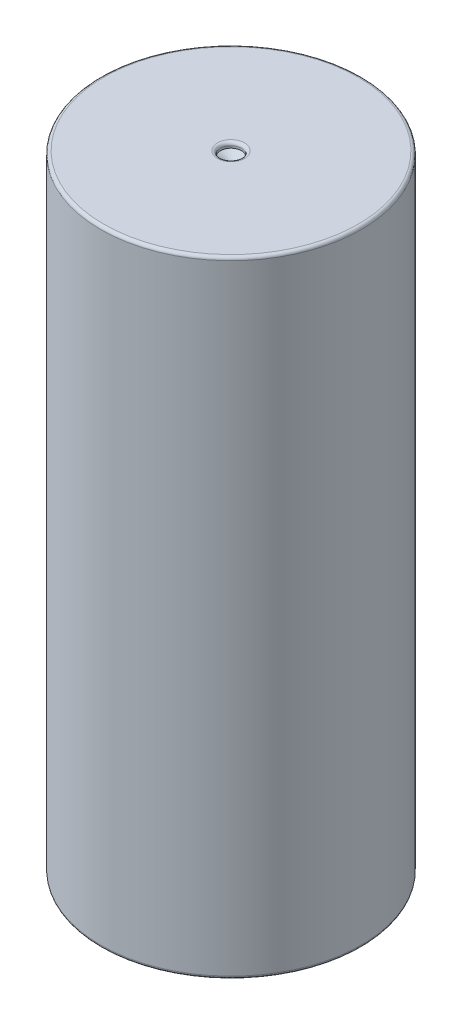
from build123d import *

# Parameters (mm, degrees)
SKETCH2_W = 12.5
SKETCH2_H = 60
FILLET1_R = 0.3


with BuildPart() as part:
    # Sketch2 → Revolve1 (revolve)
    with BuildSketch(Plane.XY, mode=Mode.PRIVATE) as revolve1_sk:
        with Locations((6.25, 0)):
            Rectangle(SKETCH2_W, SKETCH2_H)
    revolve(revolve1_sk.sketch.rotate(Axis((0, 30, 0), (0, -1, 0)), 90), axis=Axis((0, 30, 0), (0, -1, 0)))

    # Sketch4 → Cut-Revolve1 (revolve, cut)
    with BuildSketch(Plane.XY, mode=Mode.PRIVATE) as cut_revolve1_sk:
        Polygon((0, 30), (0, 29), (1, 29.5), (1, 30), align=None)
    cut_revolve1 = revolve(cut_revolve1_sk.sketch.rotate(Axis((0, 30, 0), (0, -1, 0)), 180), axis=Axis((0, 30, 0), (0, -1, 0)), mode=Mode.SUBTRACT)

    # Mirror2: Cut-Revolve1 across plane
    add(cut_revolve1.mirror(Plane.ZX), mode=Mode.SUBTRACT)

    # Fillet1
    fillet1_edges = [part.edges().sort_by_distance(p)[0] for p in [
        (1, -30, 0),
        (0, -30, -12.5),
        (0, 30, -12.5),
        (1, 30, 0),
    ]]
    fillet(fillet1_edges, radius=FILLET1_R)


solid = part.part
